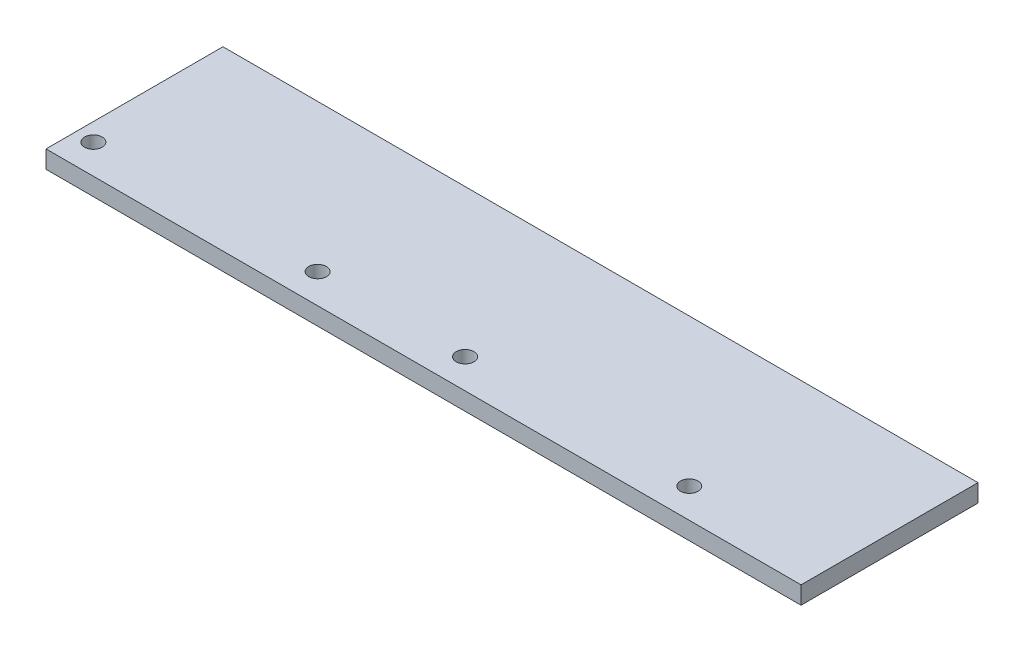
from build123d import *

# Parameters (mm, degrees)
SKETCH1_W           = 812.8
SKETCH1_H           = 190.5
BOSS_EXTRUDE1_DEPTH = 19.05
SKETCH2_R           = 9.525
CUT_EXTRUDE1_DEPTH  = 19.05


with BuildPart() as part:
    # Sketch1 → Boss-Extrude1 (new body)
    with BuildSketch(Plane(origin=(0, 0, 0), x_dir=(1, 0, 0), z_dir=(0, 1, 0))):
        with Locations((406.4, -95.25)):
            Rectangle(SKETCH1_W, SKETCH1_H)
    extrude(amount=BOSS_EXTRUDE1_DEPTH)

    # Sketch2 → Cut-Extrude1 (cut)
    with BuildSketch(Plane(origin=(0, 19.05, 0), x_dir=(1, 0, 0), z_dir=(0, 1, 0))):
        with Locations(Location((19.147048713, -158.667377817, 0), (0, 0, 270))):
            Circle(SKETCH2_R)
        with Locations(Location((260.547124517, -158.667377817, 0), (0, 0, 270))):
            Circle(SKETCH2_R)
        with Locations(Location((419.28892147, -158.667377817, 0), (0, 0, 270))):
            Circle(SKETCH2_R)
        with Locations(Location((660.646560832, -158.667377817, 0), (0, 0, 270))):
            Circle(SKETCH2_R)
    extrude(amount=-CUT_EXTRUDE1_DEPTH, mode=Mode.SUBTRACT)


solid = part.part
